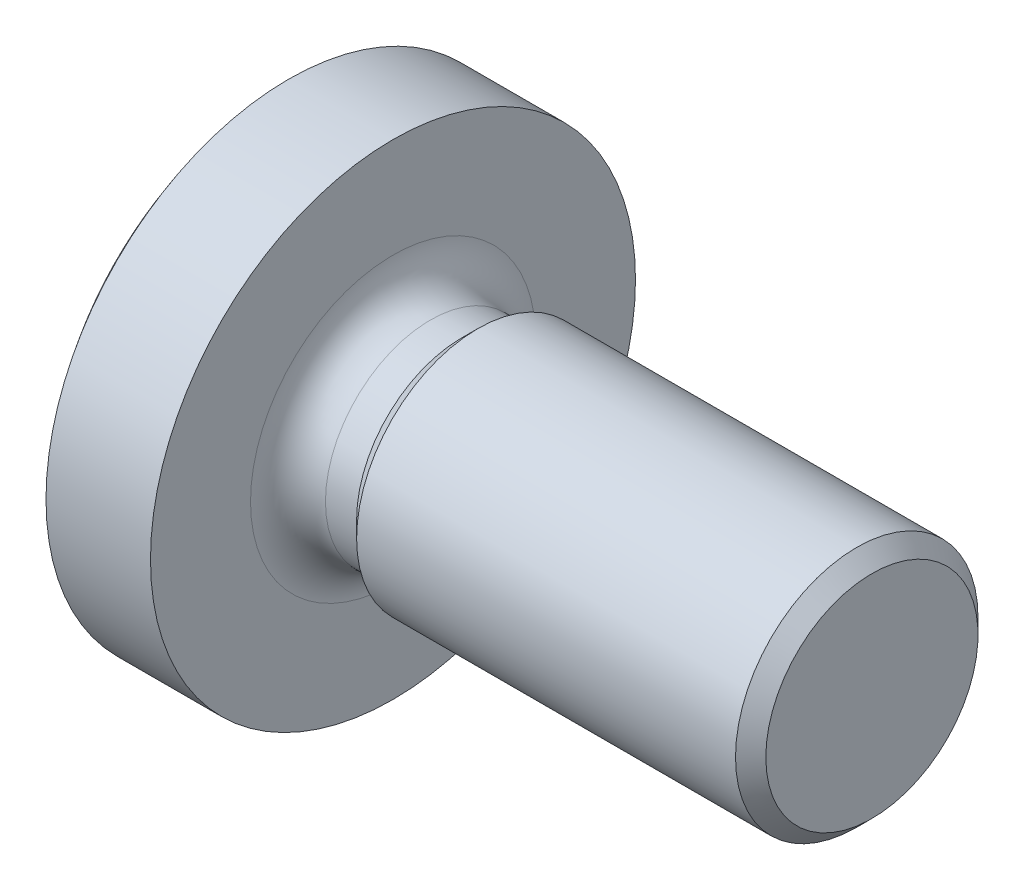
from build123d import *

# Parameters (mm, degrees)
SKETCH_7_W          = 8.1700084
SKETCH_7_H          = 5.261512758
CUT_EXTRUDE_1_DEPTH = 5
CHAMFER_1_SIZE      = 0.25


with BuildPart() as part:
    # 草图2 → Revolve 707 (revolve)
    with BuildSketch(Plane.XY, mode=Mode.PRIVATE) as revolve_707_sk:
        with BuildLine():
            Line((0, 0), (17.1, 0))
            Line((17.1, 0), (17.1, 2))
            Line((17.1, 2), (4.5, 2))
            Line((4.5, 2), (4.232, 1.732))
            Line((4.232, 1.732), (3.718, 1.732))
            ThreePointArc((3.718, 1.732), (3.281008009, 1.913008009), (3.1, 2.35))
            Line((3.1, 2.35), (3.1, 4))
            Line((3.1, 4), (1.376524617, 4))
            ThreePointArc((1.376524617, 4), (0.353757652, 2.115113473), (0, 0))
        make_face()
    revolve(revolve_707_sk.sketch.rotate(Axis((-1.331757704, 0, 0), (1, 0, 0)), 90), axis=Axis((-1.331757704, 0, 0), (1, 0, 0)))

    # 草图3 → 切除-旋转1 (revolve, cut)
    with BuildSketch(Plane.XY, mode=Mode.PRIVATE) as cut_revolve_1_sk:
        Polygon((16.753791204, 2), (17.453791204, 2), (17.1, 1.3938), align=None)
    revolve(cut_revolve_1_sk.sketch.rotate(Axis((-0.242766179, 0, 0), (1, 0, 0)), 90), axis=Axis((-0.242766179, 0, 0), (1, 0, 0)), mode=Mode.SUBTRACT)

    # 草图5 → 切除-放样1 section 0
    with BuildSketch(Plane(origin=(0, 0, 0), x_dir=(0, 0, -1), z_dir=(1, 0, 0)), mode=Mode.PRIVATE) as loft_1_s0:
        with BuildLine():
            Line((0.35, 2.2), (-0.35, 2.2))
            Line((-0.35, 2.2), (-0.35, -2.2))
            Line((-0.35, -2.2), (0.35, -2.2))
            Line((0.35, -2.2), (0.35, 2.2))
        make_face()
    loft_1 = loft([Vertex(2.4, 0, 0), loft_1_s0.sketch], mode=Mode.SUBTRACT)

    # 镜向1: 切除-放样1 across plane
    add(loft_1.mirror(Plane(origin=(0, 0, 0), x_dir=(0, 0.7071067811865462, 0.7071067811865488), z_dir=(0, -0.7071067811865488, 0.7071067811865462))), mode=Mode.SUBTRACT)

    # 草图7 → 切除-拉伸1 (cut, symmetric)
    with BuildSketch(Plane(origin=(0, 0, 0), x_dir=(1, 0, 0), z_dir=(0, 1, 0))):
        with Locations((15.0850042, 0.359536705)):
            Rectangle(SKETCH_7_W, SKETCH_7_H)
    extrude(amount=CUT_EXTRUDE_1_DEPTH, both=True, mode=Mode.SUBTRACT)

    # 倒角1
    chamfer_1_edges = [part.edges().sort_by_distance(p)[0] for p in [
        (11, 0, -2),
    ]]
    chamfer(chamfer_1_edges, length=CHAMFER_1_SIZE)


solid = part.part
